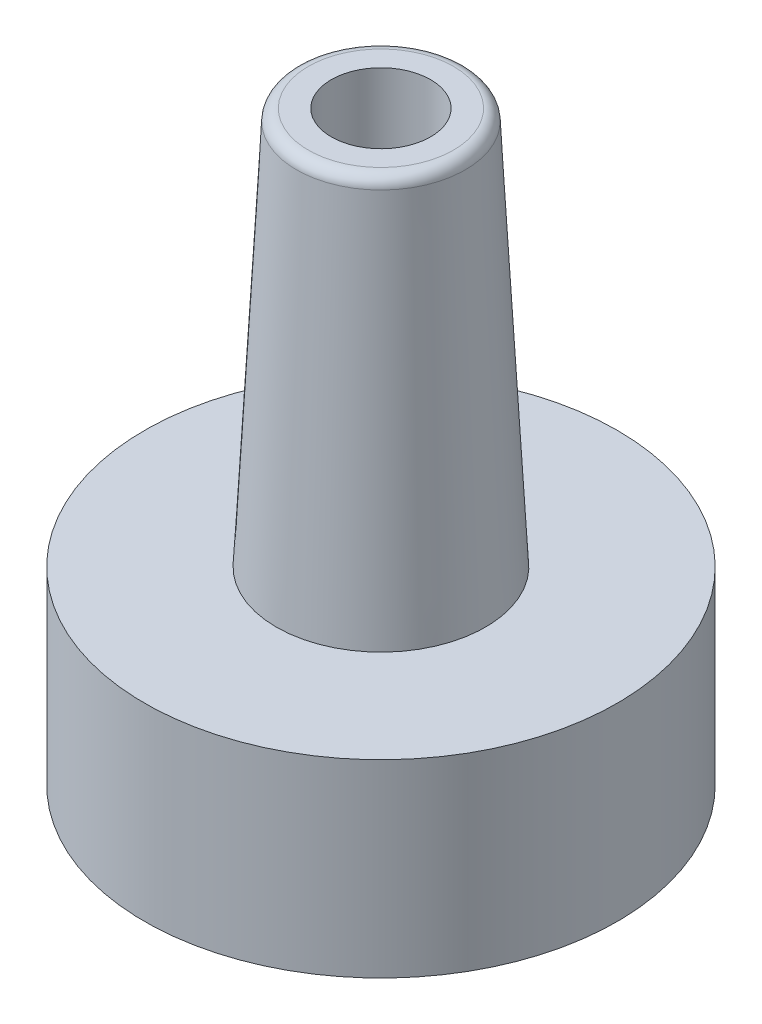
from build123d import *

# Parameters (mm, degrees)
SKETCH3_R           = 5
SKETCH3_R_2         = 0.8
BOSS_EXTRUDE1_DEPTH = 4


with BuildPart() as part:
    # Sketch2 → luer (revolve)
    with BuildSketch(Plane.XY, mode=Mode.PRIVATE) as luer_sk:
        with BuildLine():
            Line((-1.05, 0), (-2.213, 0))
            Line((-2.213, 0), (-1.785190896, 8.163083989))
            ThreePointArc((-1.785190896, 8.163083989), (-1.707622156, 8.331343593), (-1.535533512, 8.4))
            Line((-1.535533512, 8.4), (-1.05, 8.4))
            Line((-1.05, 8.4), (-1.05, 0))
        make_face()
    revolve(luer_sk.sketch.rotate(Axis((0, 0, 0), (0, 1, 0)), 270), axis=Axis((0, 0, 0), (0, 1, 0)))

    # Sketch3 → Boss-Extrude1 (add)
    with BuildSketch(Plane.XZ):
        with Locations(Location((0, 0, 0), (0, 0, 270))):
            Circle(SKETCH3_R)
        with Locations(Location((0, 0, 0), (0, 0, 270))):
            Circle(SKETCH3_R_2, mode=Mode.SUBTRACT)
    extrude(amount=BOSS_EXTRUDE1_DEPTH)


solid = part.part
